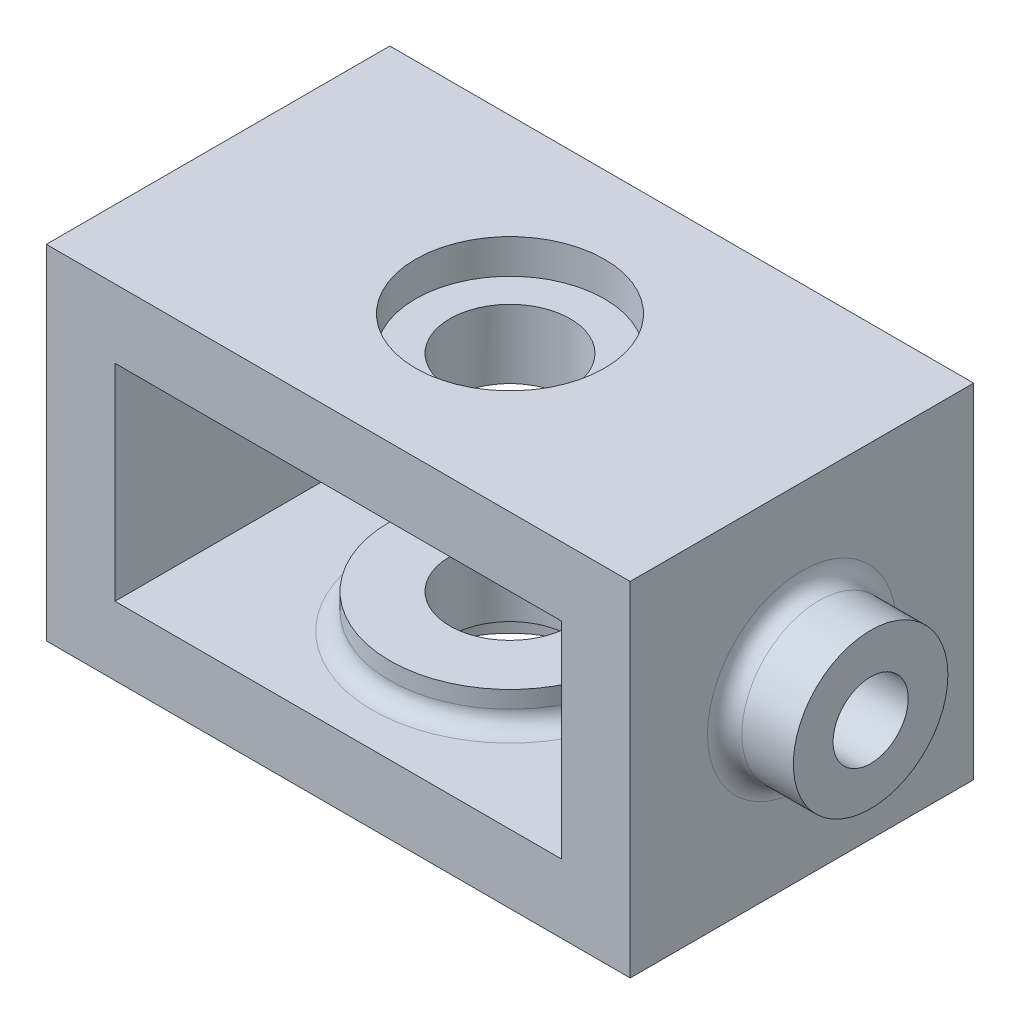
from build123d import *

# Parameters (mm, degrees)
SKETCH1_W           = 86.36
SKETCH1_H           = 50.8
BOSS_EXTRUDE1_DEPTH = 50.8
SKETCH2_R           = 5.55625
CUT_EXTRUDE1_DEPTH  = 113.335789488
SKETCH10_R          = 11.43
BOSS_EXTRUDE3_DEPTH = 10.16
SKETCH11_R          = 5.55625
CUT_EXTRUDE2_DEPTH  = 121.322027908
SKETCH12_R          = 11.43
BOSS_EXTRUDE4_DEPTH = 10.16
SKETCH13_R          = 5.55625
CUT_EXTRUDE3_DEPTH  = 129.615327236
SKETCH14_W          = 66.04
SKETCH14_H          = 30.48
CUT_EXTRUDE4_DEPTH  = 121.322027908
SKETCH15_R          = 13.97
CUT_EXTRUDE5_DEPTH  = 5.08
SKETCH16_R          = 8.89
CUT_EXTRUDE6_DEPTH  = 119.266938745
CUT_EXTRUDE7_START  = -5.08
SKETCH17_R          = 13.97
CUT_EXTRUDE7_DEPTH  = 5.08
SKETCH18_R          = 17.78
BOSS_EXTRUDE5_DEPTH = 5.08
BOSS_EXTRUDE6_START = 5.08
SKETCH19_R          = 17.78
BOSS_EXTRUDE6_DEPTH = 5.08
SKETCH21_R          = 8.89
CUT_EXTRUDE8_DEPTH  = 117.397422652
FILLET1_R           = 2.54


with BuildPart() as part:
    # Sketch1 → Boss-Extrude1 (new body)
    with BuildSketch(Plane.XY):
        with Locations((-43.18, 25.4)):
            Rectangle(SKETCH1_W, SKETCH1_H)
    extrude(amount=BOSS_EXTRUDE1_DEPTH)

    # Sketch2 → Cut-Extrude1 (cut, through all)
    with BuildSketch(Plane(origin=(0, 0, 0), x_dir=(0, 0, -1), z_dir=(1, 0, 0))):
        with Locations((-25.4, 25.4)):
            Circle(SKETCH2_R)
    extrude(amount=-CUT_EXTRUDE1_DEPTH, mode=Mode.SUBTRACT)

    # Sketch10 → Boss-Extrude3 (add)
    with BuildSketch(Plane(origin=(0, 0, 0), x_dir=(0, 0, -1), z_dir=(1, 0, 0))):
        with Locations((-25.4, 25.494050324)):
            Circle(SKETCH10_R)
    extrude(amount=BOSS_EXTRUDE3_DEPTH)

    # Sketch11 → Cut-Extrude2 (cut, through all)
    with BuildSketch(Plane(origin=(10.16, 0, 0), x_dir=(0, 0, -1), z_dir=(1, 0, 0))):
        with Locations((-25.4, 25.4)):
            Circle(SKETCH11_R)
    extrude(amount=-CUT_EXTRUDE2_DEPTH, mode=Mode.SUBTRACT)

    # Sketch12 → Boss-Extrude4 (add)
    with BuildSketch(Plane.ZY.offset(86.36)):
        with Locations(Location((25.4, 25.4, 0), (0, 0, 180))):
            Circle(SKETCH12_R)
    extrude(amount=BOSS_EXTRUDE4_DEPTH)

    # Sketch13 → Cut-Extrude3 (cut, through all)
    with BuildSketch(Plane.ZY.offset(96.52)):
        with Locations(Location((25.4, 25.4, 0), (0, 0, 180))):
            Circle(SKETCH13_R)
    extrude(amount=-CUT_EXTRUDE3_DEPTH, mode=Mode.SUBTRACT)

    # Sketch14 → Cut-Extrude4 (cut, through all)
    with BuildSketch(Plane.XY.offset(50.8)):
        with Locations((-43.18, 25.4)):
            Rectangle(SKETCH14_W, SKETCH14_H)
    extrude(amount=-CUT_EXTRUDE4_DEPTH, mode=Mode.SUBTRACT)

    # Sketch15 → Cut-Extrude5 (cut)
    with BuildSketch(Plane(origin=(0, 50.8, 0), x_dir=(1, 0, 0), z_dir=(0, 1, 0))):
        with Locations(Location((-43.18, -25.4, 0), (0, 0, 270))):
            Circle(SKETCH15_R)
    extrude(amount=-CUT_EXTRUDE5_DEPTH, mode=Mode.SUBTRACT)

    # Sketch16 → Cut-Extrude6 (cut, through all)
    with BuildSketch(Plane(origin=(0, 45.72, 0), x_dir=(1, 0, 0), z_dir=(0, 1, 0))):
        with Locations(Location((-43.18, -25.4, 0), (0, 0, 270))):
            Circle(SKETCH16_R)
    extrude(amount=-CUT_EXTRUDE6_DEPTH, mode=Mode.SUBTRACT)

    # Sketch17 → Cut-Extrude7 (cut)
    with BuildSketch(Plane.XZ.offset(CUT_EXTRUDE7_START)):
        with Locations(Location((-43.18, 25.4, 0), (0, 0, 90))):
            Circle(SKETCH17_R)
    extrude(amount=CUT_EXTRUDE7_DEPTH, mode=Mode.SUBTRACT)

    # Sketch18 → Boss-Extrude5 (add)
    with BuildSketch(Plane(origin=(0, 10.16, 0), x_dir=(1, 0, 0), z_dir=(0, 1, 0))):
        with Locations((-43.18, -25.4)):
            Circle(SKETCH18_R)
    extrude(amount=BOSS_EXTRUDE5_DEPTH)

    # Sketch19 → Boss-Extrude6 (add)
    with BuildSketch(Plane.XZ.offset(-40.64).offset(BOSS_EXTRUDE6_START)):
        with Locations((-43.18, 25.4)):
            Circle(SKETCH19_R)
    extrude(amount=-BOSS_EXTRUDE6_DEPTH)

    # Sketch21 → Cut-Extrude8 (cut, through all)
    with BuildSketch(Plane(origin=(0, 10.16, 0), x_dir=(-1, 0, 0), z_dir=(0, -1, 0))):
        with Locations((43.18, -25.4)):
            Circle(SKETCH21_R)
    extrude(amount=-CUT_EXTRUDE8_DEPTH, mode=Mode.SUBTRACT)

    # Fillet1
    fillet1_edges = [part.edges().sort_by_distance(p)[0] for p in [
        (0, 25.494050324, 36.83),
        (-86.36, 25.4, 36.83),
        (-60.96, 10.16, 25.4),
        (-60.96, 40.64, 25.4),
    ]]
    fillet(fillet1_edges, radius=FILLET1_R)


solid = part.part
